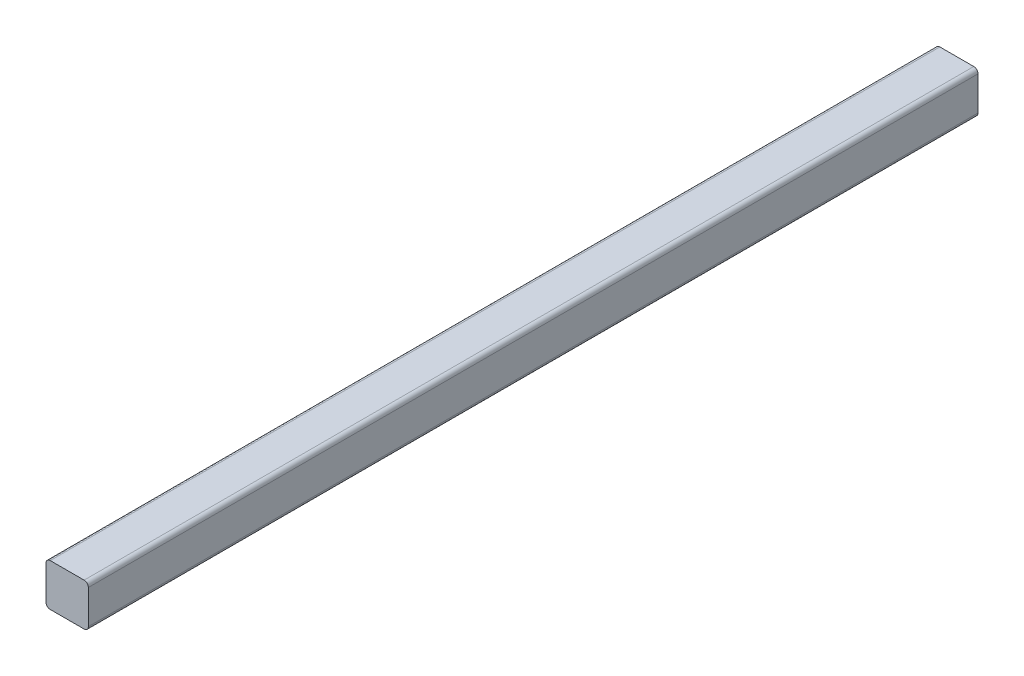
from build123d import *

# Parameters (mm, degrees)
SKETCH1_W           = 5
SKETCH1_H           = 5
BOSS_EXTRUDE1_DEPTH = 105
FILLET1_R           = 0.5


with BuildPart() as part:
    # Sketch1 → Boss-Extrude1 (new body)
    with BuildSketch(Plane.XY):
        Rectangle(SKETCH1_W, SKETCH1_H)
    extrude(amount=-BOSS_EXTRUDE1_DEPTH)

    # Fillet1
    fillet1_edges = [part.edges().sort_by_distance(p)[0] for p in [
        (2.5, -2.5, -52.5),
        (-2.5, -2.5, -52.5),
        (-2.5, 2.5, -52.5),
        (2.5, 2.5, -52.5),
    ]]
    fillet(fillet1_edges, radius=FILLET1_R)


solid = part.part
